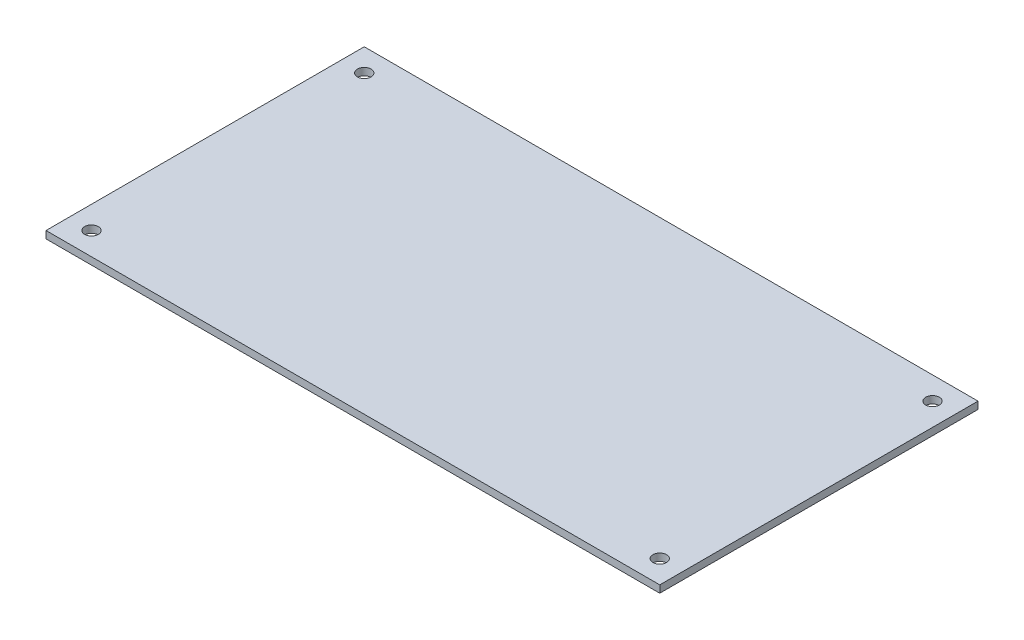
from build123d import *

# Parameters (mm, degrees)
SKETCH1_W                      = 135
SKETCH1_H                      = 70
BOSS_EXTRUDE1_DEPTH            = 1.6
CUT_EXTRUDE1_REACH             = 78.051
SKETCH2_R                      = 1.5
CUT_EXTRUDE1_DIRECTION_2_DEPTH = 77.051364222


with BuildPart() as part:
    # Sketch1 → Boss-Extrude1 (new body)
    with BuildSketch(Plane(origin=(0, 0, 0), x_dir=(1, 0, 0), z_dir=(0, 1, 0))):
        Rectangle(SKETCH1_W, SKETCH1_H)
    extrude(amount=BOSS_EXTRUDE1_DEPTH)

    # Sketch2 → Cut-Extrude1 (cut, up to next)
    with BuildSketch(Plane(origin=(0, 1.6, 0), x_dir=(1, 0, 0), z_dir=(0, 1, 0)), mode=Mode.PRIVATE) as cut_extrude1_sk1:
        with Locations(Location((-62.5, 30, 0), (0, 0, 90))):
            Circle(SKETCH2_R)
    cut_extrude1_tool1 = extrude(cut_extrude1_sk1.sketch, amount=-CUT_EXTRUDE1_REACH, mode=Mode.PRIVATE) & part.part
    # Sketch2 → Cut-Extrude1 (cut, up to next)
    with BuildSketch(Plane(origin=(0, 1.6, 0), x_dir=(1, 0, 0), z_dir=(0, 1, 0)), mode=Mode.PRIVATE) as cut_extrude1_sk2:
        with Locations(Location((62.5, 30, 0), (0, 0, 90))):
            Circle(SKETCH2_R)
    cut_extrude1_tool2 = extrude(cut_extrude1_sk2.sketch, amount=-CUT_EXTRUDE1_REACH, mode=Mode.PRIVATE) & part.part
    # Sketch2 → Cut-Extrude1 (cut, up to next)
    with BuildSketch(Plane(origin=(0, 1.6, 0), x_dir=(1, 0, 0), z_dir=(0, 1, 0)), mode=Mode.PRIVATE) as cut_extrude1_sk3:
        with Locations(Location((62.5, -30, 0), (0, 0, 90))):
            Circle(SKETCH2_R)
    cut_extrude1_tool3 = extrude(cut_extrude1_sk3.sketch, amount=-CUT_EXTRUDE1_REACH, mode=Mode.PRIVATE) & part.part
    # Sketch2 → Cut-Extrude1 (cut, up to next)
    with BuildSketch(Plane(origin=(0, 1.6, 0), x_dir=(1, 0, 0), z_dir=(0, 1, 0)), mode=Mode.PRIVATE) as cut_extrude1_sk4:
        with Locations(Location((-62.5, -30, 0), (0, 0, 90))):
            Circle(SKETCH2_R)
    cut_extrude1_tool4 = extrude(cut_extrude1_sk4.sketch, amount=-CUT_EXTRUDE1_REACH, mode=Mode.PRIVATE) & part.part
    add(cut_extrude1_tool1.solids().sort_by_distance((-62.5, 1.6, -30))[0], mode=Mode.SUBTRACT)
    add(cut_extrude1_tool2.solids().sort_by_distance((62.5, 1.6, -30))[0], mode=Mode.SUBTRACT)
    add(cut_extrude1_tool3.solids().sort_by_distance((62.5, 1.6, 30))[0], mode=Mode.SUBTRACT)
    add(cut_extrude1_tool4.solids().sort_by_distance((-62.5, 1.6, 30))[0], mode=Mode.SUBTRACT)

    # Sketch2 → Cut-Extrude1 direction 2 (cut)
    with BuildSketch(Plane(origin=(0, 1.6, 0), x_dir=(1, 0, 0), z_dir=(0, 1, 0))):
        with Locations(Location((-62.5, 30, 0), (0, 0, 90))):
            Circle(SKETCH2_R)
        with Locations(Location((62.5, 30, 0), (0, 0, 90))):
            Circle(SKETCH2_R)
        with Locations(Location((62.5, -30, 0), (0, 0, 90))):
            Circle(SKETCH2_R)
        with Locations(Location((-62.5, -30, 0), (0, 0, 90))):
            Circle(SKETCH2_R)
    extrude(amount=CUT_EXTRUDE1_DIRECTION_2_DEPTH, mode=Mode.SUBTRACT)


solid = part.part
